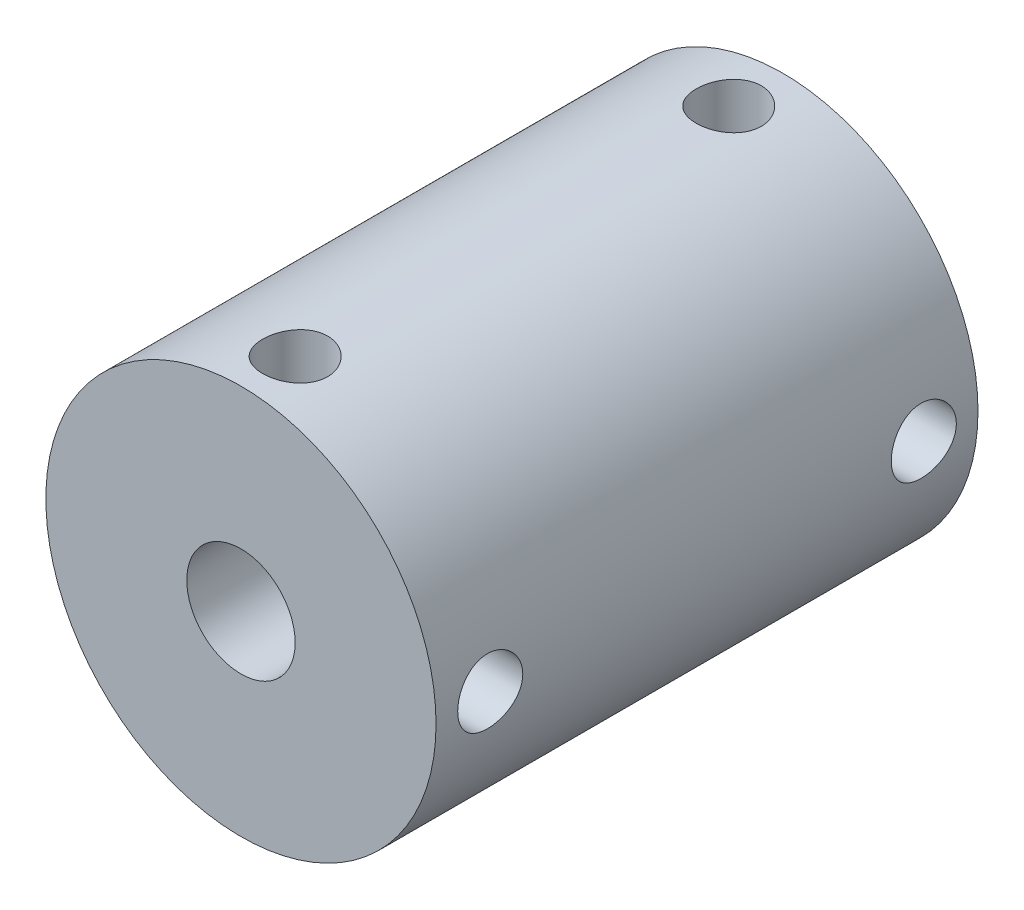
from build123d import *

# Parameters (mm, degrees)
SKETCH1_R           = 9
BOSS_EXTRUDE1_DEPTH = 12.5
SKETCH2_R           = 2.5
CUT_EXTRUDE1_DEPTH  = 29.053520278
SKETCH3_R           = 1.5
CUT_EXTRUDE2_DEPTH  = 18.839562775
SKETCH4_R           = 1.5
CUT_EXTRUDE3_DEPTH  = 18.839562946


with BuildPart() as part:
    # Sketch1 → Boss-Extrude1 (new, symmetric)
    with BuildSketch(Plane.XY):
        Circle(SKETCH1_R)
    extrude(amount=BOSS_EXTRUDE1_DEPTH, both=True)

    # Sketch2 → Cut-Extrude1 (cut, through all)
    with BuildSketch(Plane.XY.offset(12.5)):
        Circle(SKETCH2_R)
    extrude(amount=-CUT_EXTRUDE1_DEPTH, mode=Mode.SUBTRACT)

    # Sketch3 → Cut-Extrude2 (cut, through all)
    with BuildSketch(Plane(origin=(0, 0, 0), x_dir=(1, 0, 0), z_dir=(0, 1, 0))):
        with Locations(Location((0, 10, 0), (0, 0, 90))):
            Circle(SKETCH3_R)
        with Locations(Location((0, -10, 0), (0, 0, 90))):
            Circle(SKETCH3_R)
    extrude(amount=CUT_EXTRUDE2_DEPTH, mode=Mode.SUBTRACT)

    # Sketch4 → Cut-Extrude3 (cut, through all)
    with BuildSketch(Plane(origin=(0, 0, 0), x_dir=(0, 0, -1), z_dir=(1, 0, 0))):
        with Locations(Location((-10, 0, 0), (0, 0, 180))):
            Circle(SKETCH4_R)
        with Locations(Location((10, 0, 0), (0, 0, 180))):
            Circle(SKETCH4_R)
    extrude(amount=CUT_EXTRUDE3_DEPTH, mode=Mode.SUBTRACT)


solid = part.part
